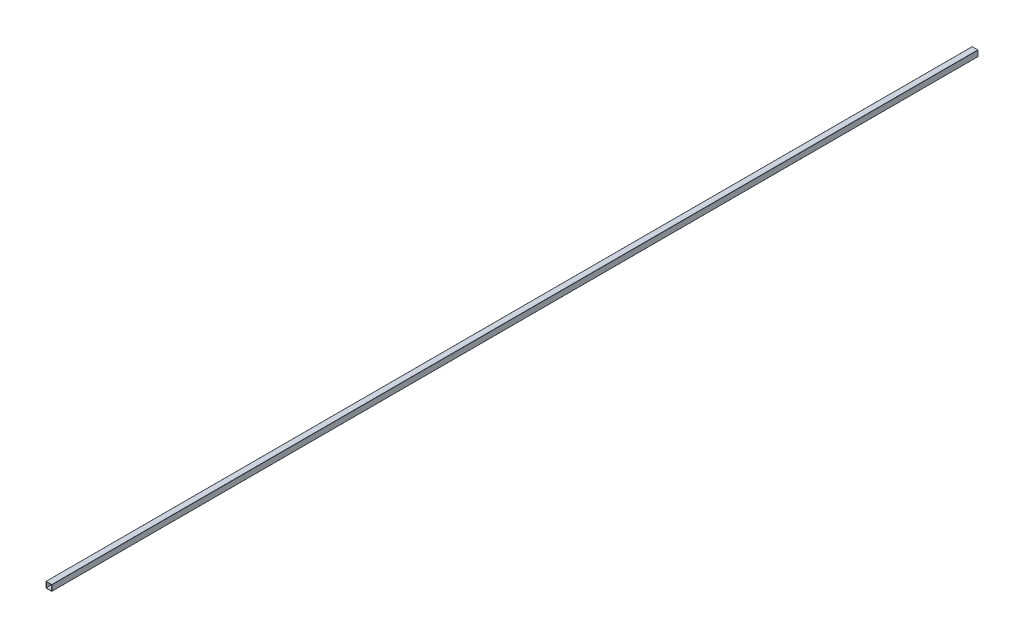
from build123d import *

# Parameters (mm, degrees)
CROQUIS1_W              = 34.32
CROQUIS1_H              = 34.32
SALIENTE_EXTRUIR1_DEPTH = 6000


with BuildPart() as part:
    # Croquis1 → Saliente-Extruir1 (new body)
    with BuildSketch(Plane.XY):
        with BuildLine():
            Line((-18.05, -19.05), (18.05, -19.05))
            ThreePointArc((18.05, -19.05), (18.757106781, -18.757106781), (19.05, -18.05))
            Line((19.05, -18.05), (19.05, 18.05))
            ThreePointArc((19.05, 18.05), (18.757106781, 18.757106781), (18.05, 19.05))
            Line((18.05, 19.05), (-18.05, 19.05))
            ThreePointArc((-18.05, 19.05), (-18.757106781, 18.757106781), (-19.05, 18.05))
            Line((-19.05, 18.05), (-19.05, -18.05))
            ThreePointArc((-19.05, -18.05), (-18.757106781, -18.757106781), (-18.05, -19.05))
        make_face()
        Rectangle(CROQUIS1_W, CROQUIS1_H, mode=Mode.SUBTRACT)
    extrude(amount=SALIENTE_EXTRUIR1_DEPTH)


solid = part.part
